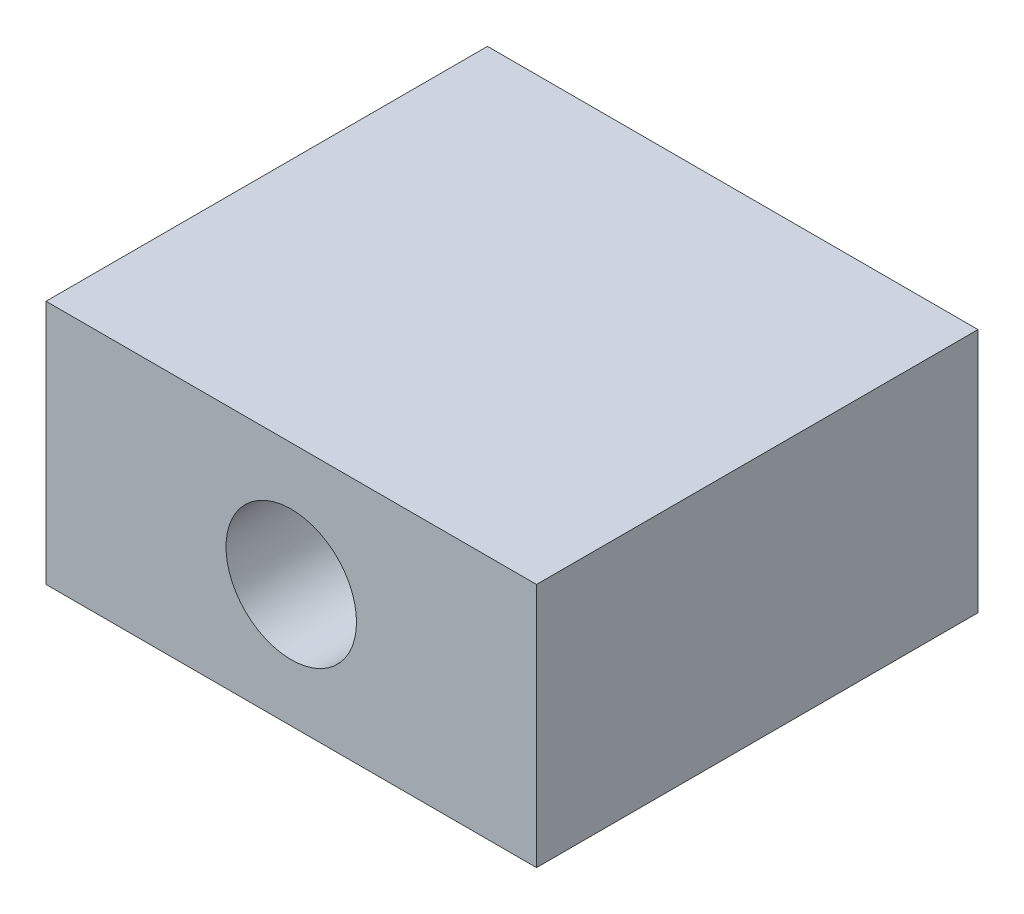
from build123d import *

# Parameters (mm, degrees)
SKETCH1_W                         = 25.4
SKETCH1_H                         = 12.7
EXTRUDE1_DEPTH                    = 22.86
F_1_4_CLEARANCE_HOLE1_D           = 6.7564
F_1_4_CLEARANCE_HOLE1_ON_FACE_2_D = 6.7564


with BuildPart() as part:
    # Sketch1 → Extrude1 (new body)
    with BuildSketch(Plane.XY):
        Rectangle(SKETCH1_W, SKETCH1_H)
    extrude(amount=EXTRUDE1_DEPTH)

    # 1/4 Clearance Hole1 (through all)
    with Locations(Plane(origin=(0, 0, 0), x_dir=(-1, 0, 0), z_dir=(0, 0, -1))):
        with Locations((0, 0)):
            Hole(F_1_4_CLEARANCE_HOLE1_D / 2)

    # 1/4 Clearance Hole1 on face 2 (through all)
    with Locations(Plane.XY.offset(22.86)):
        with Locations((0, 0)):
            Hole(F_1_4_CLEARANCE_HOLE1_ON_FACE_2_D / 2)


solid = part.part
